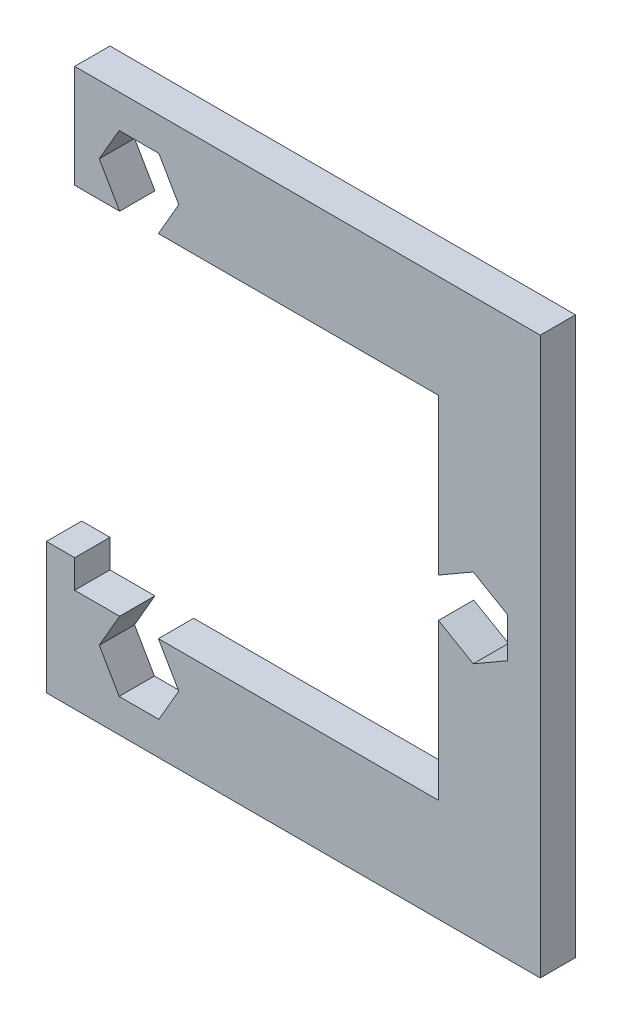
from build123d import *

# Parameters (mm, degrees)
BOSS_EXTRUDE1_DEPTH = 3.175


with BuildPart() as part:
    # Sketch1 → Boss-Extrude1 (new body)
    with BuildSketch(Plane.XY):
        Polygon((7421.357987496, 3420.456636514), (7421.357987496, 3429.727636514), (7463.267987496, 3429.727636514), (7463.267987496, 3379.613436514), (7418.817987496, 3379.613436514), (7418.817987496, 3391.424436514), (7421.357987496, 3391.424436514), (7421.357987496, 3388.884436514), (7425.404088572, 3388.884436514), (7423.571001467, 3385.709436514), (7425.360094482, 3382.610636514), (7428.93828051, 3382.610636514), (7430.727373524, 3385.709436514), (7428.894286419, 3388.884436514), (7454.098587496, 3388.884436514), (7454.098587496, 3402.903366886), (7457.235359913, 3401.092350486), (7460.334159913, 3402.8814435), (7460.334159913, 3406.459629528), (7457.235359913, 3408.248722542), (7454.098587496, 3406.437706143), (7454.098587496, 3420.456636514), (7428.894286419, 3420.456636514), (7430.727373524, 3423.631636514), (7428.93828051, 3426.730436514), (7425.360094482, 3426.730436514), (7423.571001467, 3423.631636514), (7425.404088572, 3420.456636514), align=None)
    extrude(amount=BOSS_EXTRUDE1_DEPTH)


solid = part.part
